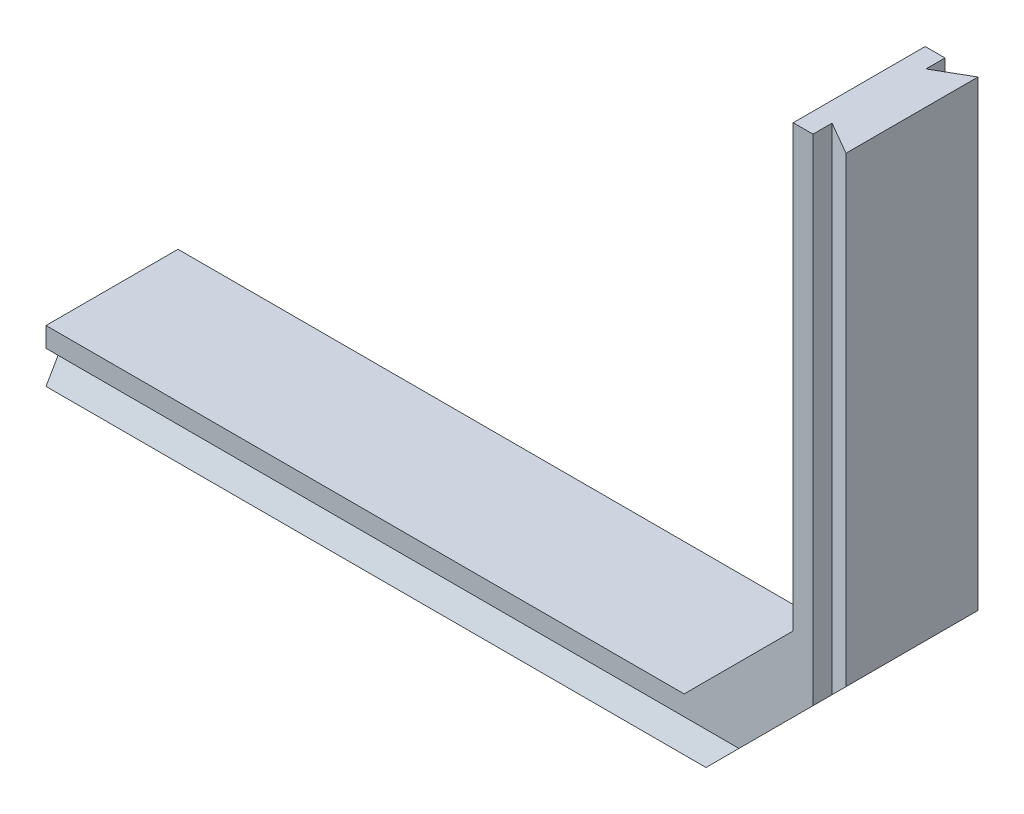
from build123d import *

# Parameters (mm, degrees)
EXTRUDE_1_DEPTH     = 20
CUT_EXTRUDE_1_DEPTH = 149.381528207
CUT_EXTRUDE_2_DEPTH = 154.011402085


with BuildPart() as part:
    # Эскиз1 → Бобышка-Вытянуть1 (new body)
    with BuildSketch(Plane.XY):
        Polygon((0, 0), (0, -8), (100, -8), (121.213203436, 13.213203436), (121.213203436, 83.213203436), (113.213203436, 83.213203436), (113.213203436, 16.526911935), (96.686291501, 0), align=None)
    extrude(amount=EXTRUDE_1_DEPTH)

    # Эскиз2 → Вырез-Вытянуть1 (cut, through all)
    with BuildSketch(Plane.ZY):
        Polygon((0, -3), (2.886751346, -3), (0, -8), align=None)
        Polygon((20, -8), (20, -3), (17.113248654, -3), align=None)
    extrude(amount=-CUT_EXTRUDE_1_DEPTH, mode=Mode.SUBTRACT)

    # Эскиз3 → Вырез-Вытянуть2 (cut, through all)
    with BuildSketch(Plane(origin=(0, 83.213203436, 0), x_dir=(1, 0, 0), z_dir=(0, 1, 0))):
        Polygon((116.213203436, -20), (116.213203436, -17.113248654), (121.213203436, -20), align=None)
        Polygon((121.213203436, 0), (116.213203436, 0), (116.213203436, -2.886751346), align=None)
    extrude(amount=-CUT_EXTRUDE_2_DEPTH, mode=Mode.SUBTRACT)


solid = part.part
